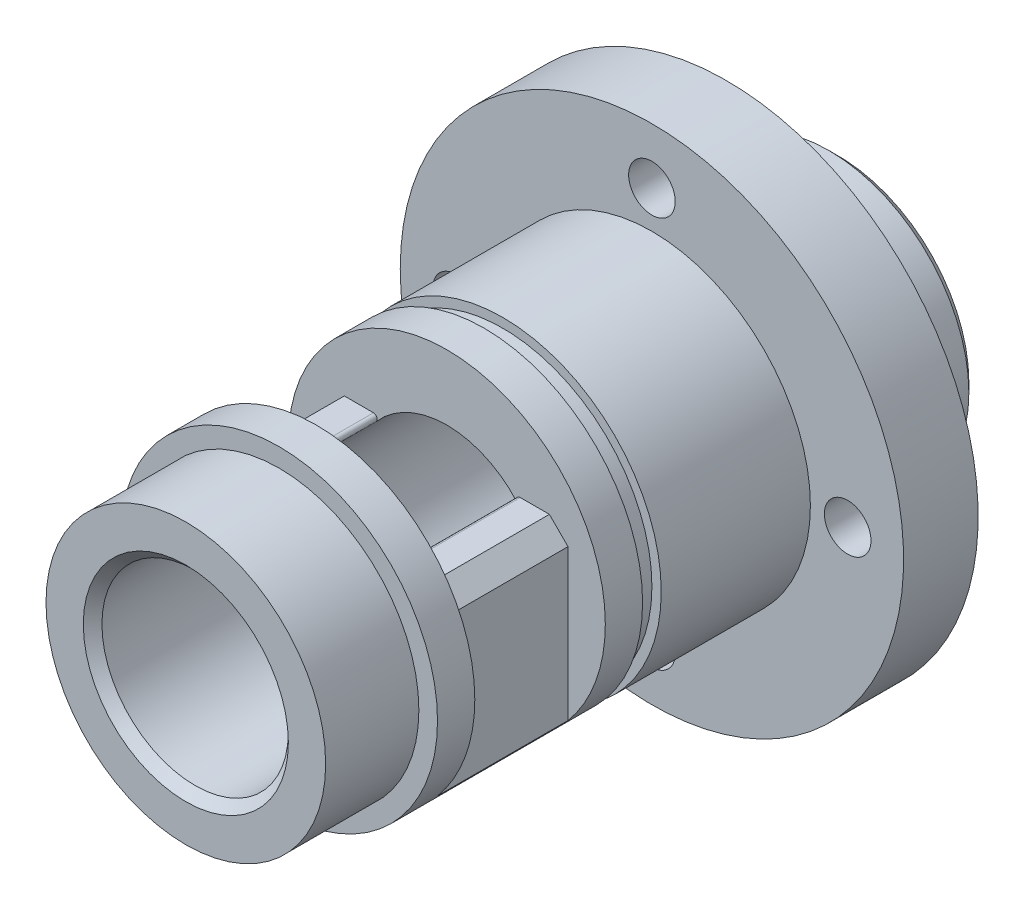
from build123d import *

# Parameters (mm, degrees)
SKETCH_1_R          = 8.5
EXTRUDE_1_DEPTH     = 20
SKETCH_2_R          = 7.5
EXTRUDE_2_DEPTH     = 5
SKETCH_3_R          = 8.5
SKETCH_3_R_2        = 8
CUT_EXTRUDE_1_DEPTH = 1
SKETCH_5_R          = 13.5
EXTRUDE_3_DEPTH     = 4
EXTRUDE_START       = 6
SKETCH_7_R          = 7.5
EXTRUDE_4_DEPTH     = 6
SKETCH_9_R          = 5
CUT_EXTRUDE_3_DEPTH = 40.868533958
CHAMFER_2_SIZE      = 0.5
CUT_EXTRUDE_START   = -7
CUT_EXTRUDE_4_DEPTH = 7
SKETCH_12_W         = 4
SKETCH_12_H         = 7
CUT_EXTRUDE_5_DEPTH = 34.161121815
CHAMFER_3_SIZE      = 0.5
CHAMFER_4_SIZE      = 1
FILLET_1_R          = 0.2
HOLE_WIZARD_M3_1_D  = 2.5


with BuildPart() as part:
    # 草图1 → 凸台-拉伸1 (new body)
    with BuildSketch(Plane.XY):
        Circle(SKETCH_1_R)
    extrude(amount=EXTRUDE_1_DEPTH)

    # 草图2 → 凸台-拉伸2 (add)
    with BuildSketch(Plane.XY.offset(20)):
        Circle(SKETCH_2_R)
    extrude(amount=EXTRUDE_2_DEPTH)

    # 草图3 → 切除-拉伸1 (cut)
    with BuildSketch(Plane.XY.offset(8)):
        Circle(SKETCH_3_R)
        Circle(SKETCH_3_R_2, mode=Mode.SUBTRACT)
    extrude(amount=CUT_EXTRUDE_1_DEPTH, mode=Mode.SUBTRACT)

    # 草图5 → 凸台-拉伸3 (add)
    with BuildSketch(Plane(origin=(0, 0, 0), x_dir=(-1, 0, 0), z_dir=(0, 0, -1))):
        Circle(SKETCH_5_R)
    extrude(amount=EXTRUDE_3_DEPTH)

    # 草图7 → 凸台-拉伸4 (add)
    with BuildSketch(Plane(origin=(0, 0, -4), x_dir=(-1, 0, 0), z_dir=(0, 0, -1)).offset(EXTRUDE_START)):
        with Locations(Location((0, 0, 0), (0, 0, 180))):
            Circle(SKETCH_7_R)
    extrude(amount=-EXTRUDE_4_DEPTH)

    # 草图9 → 切除-拉伸3 (cut, through all)
    with BuildSketch(Plane(origin=(0, 0, -10), x_dir=(-1, 0, 0), z_dir=(0, 0, -1))):
        Circle(SKETCH_9_R)
    extrude(amount=-CUT_EXTRUDE_3_DEPTH, mode=Mode.SUBTRACT)

    # 倒角2
    chamfer_2_edges = [part.edges().sort_by_distance(p)[0] for p in [
        (-7.5, 0, -10),
    ]]
    chamfer(chamfer_2_edges, length=CHAMFER_2_SIZE)

    # 草图10 → 切除-拉伸4 (cut)
    with BuildSketch(Plane.XY.offset(18).offset(CUT_EXTRUDE_START)):
        with BuildLine():
            Line((-7.7, 3.6), (7.7, 3.6))
            ThreePointArc((7.7, 3.6), (0, 8.5), (-7.7, 3.6))
        make_face()
        with BuildLine():
            Line((-6.020797289, -6), (6.020797289, -6))
            ThreePointArc((6.020797289, -6), (0, -8.5), (-6.020797289, -6))
        make_face()
    extrude(amount=CUT_EXTRUDE_4_DEPTH, mode=Mode.SUBTRACT)

    # 草图12 → 切除-拉伸5 (cut, through all)
    with BuildSketch(Plane(origin=(0, 3.6, 0), x_dir=(1, 0, 0), z_dir=(0, 1, 0))):
        with Locations((-8.5, -14.5)):
            Rectangle(SKETCH_12_W, SKETCH_12_H)
        with Locations((8.5, -14.5)):
            Rectangle(SKETCH_12_W, SKETCH_12_H)
    extrude(amount=-CUT_EXTRUDE_5_DEPTH, mode=Mode.SUBTRACT)

    # 倒角3
    chamfer_3_edges = [part.edges().sort_by_distance(p)[0] for p in [
        (5, 0, 25),
    ]]
    chamfer(chamfer_3_edges, length=CHAMFER_3_SIZE)

    # 倒角4
    chamfer_4_edges = [part.edges().sort_by_distance(p)[0] for p in [
        (-6.5, 3.6, 14.5),
        (6.5, 3.6, 14.5),
    ]]
    chamfer(chamfer_4_edges, length=CHAMFER_4_SIZE)

    # 圆角1
    fillet_1_edges = [part.edges().sort_by_distance(p)[0] for p in [
        (3.469870315, 3.6, 14.5),
        (-3.469870315, 3.6, 14.5),
    ]]
    fillet(fillet_1_edges, radius=FILLET_1_R)

    # M3 螺纹孔1 (through all)
    with Locations(Plane(origin=(0, 0, -4), x_dir=(-1, 0, 0), z_dir=(0, 0, -1))):
        with Locations((-10.5, 0), (0, 10.5), (10.5, 0), (0, -10.5)):
            Hole(HOLE_WIZARD_M3_1_D / 2)


solid = part.part
